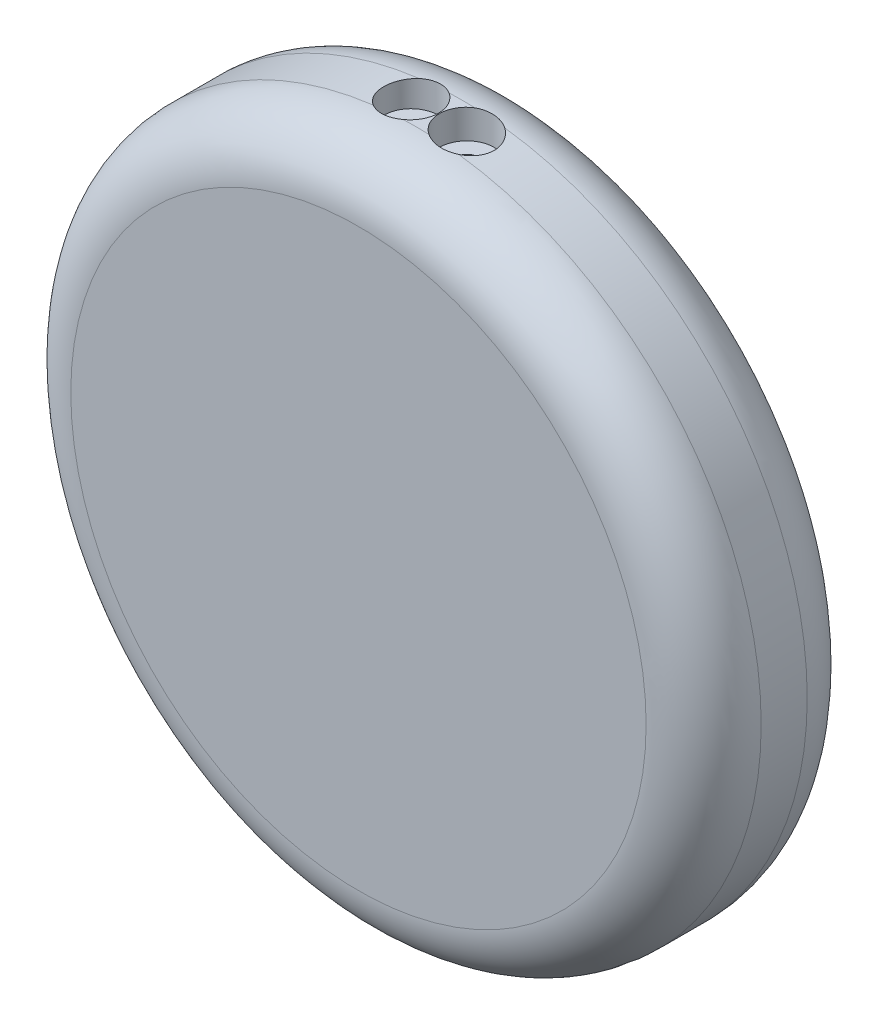
from build123d import *

# Parameters (mm, degrees)
SKETCH1_R               = 75
BOSS_EXTRUDE1_DEPTH     = 35
CUT_EXTRUDE1_DEPTH      = 112.691539518
CUT_EXTRUDE1_DEPTH_BACK = 112.691539518
SKETCH2_R               = 2.38125
FILLET1_R               = 12.5
SKETCH3_R               = 5.953125
CUT_EXTRUDE2_DEPTH      = 6.35


with BuildPart() as part:
    # Sketch1 → Boss-Extrude1 (new body)
    with BuildSketch(Plane.XY):
        Circle(SKETCH1_R)
    extrude(amount=BOSS_EXTRUDE1_DEPTH)

    # Sketch2 → Cut-Extrude1 (cut, two sides: drawn at the far end of the back side and taken through both)
    with BuildSketch(Plane(origin=(0, 0, 0), x_dir=(1, 0, 0), z_dir=(0, 1, 0)).offset(-CUT_EXTRUDE1_DEPTH_BACK)):
        with Locations(Location((-6.045, -17.5, 0), (0, 0, 270))):
            Circle(SKETCH2_R)
        with Locations(Location((6.045, -17.5, 0), (0, 0, 270))):
            Circle(SKETCH2_R)
    extrude(amount=CUT_EXTRUDE1_DEPTH + CUT_EXTRUDE1_DEPTH_BACK, mode=Mode.SUBTRACT)

    # Fillet1
    fillet1_edges = [part.edges().sort_by_distance(p)[0] for p in [
        (-75, 0, 0),
        (-75, 0, 35),
    ]]
    fillet(fillet1_edges, radius=FILLET1_R)

    # Sketch3 → Cut-Extrude2 (cut)
    with BuildSketch(Plane(origin=(0, 75, 0), x_dir=(1, 0, 0), z_dir=(0, 1, 0))):
        with Locations(Location((-6.045, -17.5, 0), (0, 0, 270))):
            Circle(SKETCH3_R)
        with Locations(Location((6.045, -17.5, 0), (0, 0, 270))):
            Circle(SKETCH3_R)
    extrude(amount=-CUT_EXTRUDE2_DEPTH, mode=Mode.SUBTRACT)


solid = part.part
